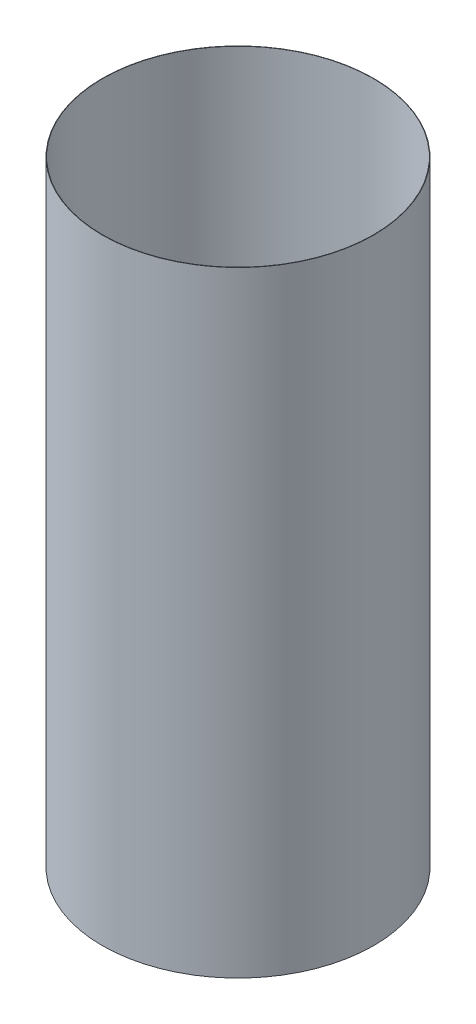
from build123d import *

# Parameters (mm, degrees)
SKETCH1_R           = 23.8125
SKETCH1_R_2         = 23.749
BOSS_EXTRUDE1_DEPTH = 107.95


with BuildPart() as part:
    # Sketch1 → Boss-Extrude1 (new body)
    with BuildSketch(Plane(origin=(0, 0, 0), x_dir=(1, 0, 0), z_dir=(0, 1, 0))):
        with Locations(Location((0, 0, 0), (0, 0, 270))):
            Circle(SKETCH1_R)
        with Locations(Location((0, 0, 0), (0, 0, 270))):
            Circle(SKETCH1_R_2, mode=Mode.SUBTRACT)
    extrude(amount=BOSS_EXTRUDE1_DEPTH)


solid = part.part
